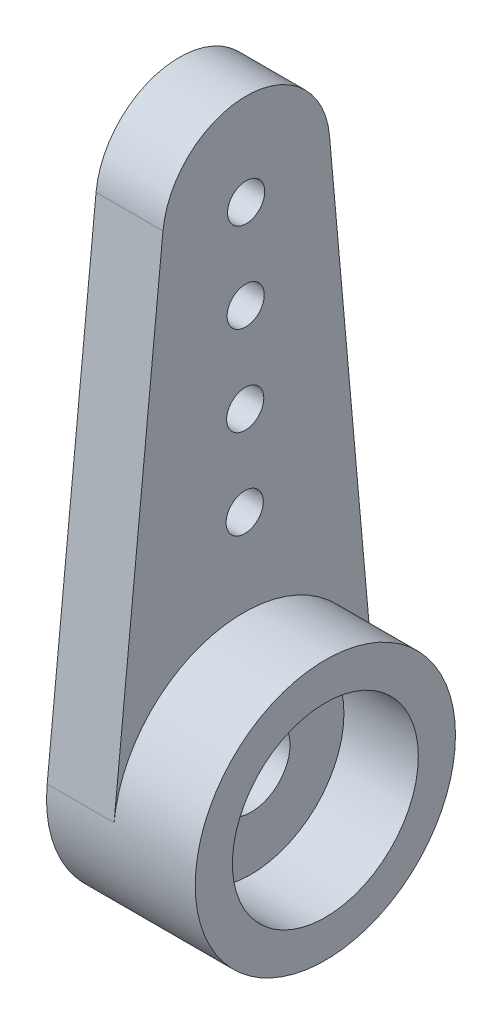
from build123d import *

# Parameters (mm, degrees)
IZIM1_R                     = 1.05
Y_KSEKLIK_EKSTR_ZYON1_DEPTH = 4
IZIM1_5_R                   = 0.5
Y_KSEKLIK_EKSTR_ZYON2_DEPTH = 1.8
IZIM2_R                     = 2.5
KES_EKSTR_ZYON1_DEPTH       = 2


with BuildPart() as part:
    # Çizim1 → Yükseklik-Ekstrüzyon1 (new body)
    with BuildSketch(Plane(origin=(0, 0, 0), x_dir=(0, 0, -1), z_dir=(1, 0, 0))):
        with BuildLine():
            ThreePointArc((589.020937835, 415.367382833), (585.553599597, 418.555843854), (582.052256525, 415.40476232))
            ThreePointArc((582.052256525, 415.40476232), (585.360174488, 411.560254519), (589.034826128, 415.055894204))
            ThreePointArc((589.034826128, 415.055894204), (589.031352331, 415.211793251), (589.020937835, 415.367382833))
        make_face()
        with Locations((585.534826128, 415.055894204)):
            Circle(IZIM1_R, mode=Mode.SUBTRACT)
    extrude(amount=Y_KSEKLIK_EKSTR_ZYON1_DEPTH)

    # Çizim1<5> → Yükseklik-Ekstrüzyon2 (add)
    with BuildSketch(Plane(origin=(0, 0, 0), x_dir=(0, 0, -1), z_dir=(1, 0, 0))):
        with BuildLine():
            Line((583.367103568, 428.530198932), (582.052256525, 415.40476232))
            ThreePointArc((582.052256525, 415.40476232), (585.553599597, 418.555843854), (589.020937835, 415.367382833))
            Line((589.020937835, 415.367382833), (587.846970124, 428.506169262))
            ThreePointArc((587.846970124, 428.506169262), (585.617966971, 430.555894204), (583.367103568, 428.530198932))
        make_face()
        with Locations((585.566071769, 420.8810388)):
            Circle(IZIM1_5_R, mode=Mode.SUBTRACT)
        with Locations((585.57894519, 423.2810388)):
            Circle(IZIM1_5_R, mode=Mode.SUBTRACT)
        with Locations((585.591818611, 425.6810388)):
            Circle(IZIM1_5_R, mode=Mode.SUBTRACT)
        with Locations((585.604692031, 428.0810388)):
            Circle(IZIM1_5_R, mode=Mode.SUBTRACT)
    extrude(amount=Y_KSEKLIK_EKSTR_ZYON2_DEPTH)

    # Çizim2 → Kes-Ekstrüzyon1 (cut)
    with BuildSketch(Plane(origin=(4, 0, 0), x_dir=(0, 0, -1), z_dir=(1, 0, 0))):
        with Locations((585.534826128, 415.055894204)):
            Circle(IZIM2_R)
    extrude(amount=-KES_EKSTR_ZYON1_DEPTH, mode=Mode.SUBTRACT)


solid = part.part
